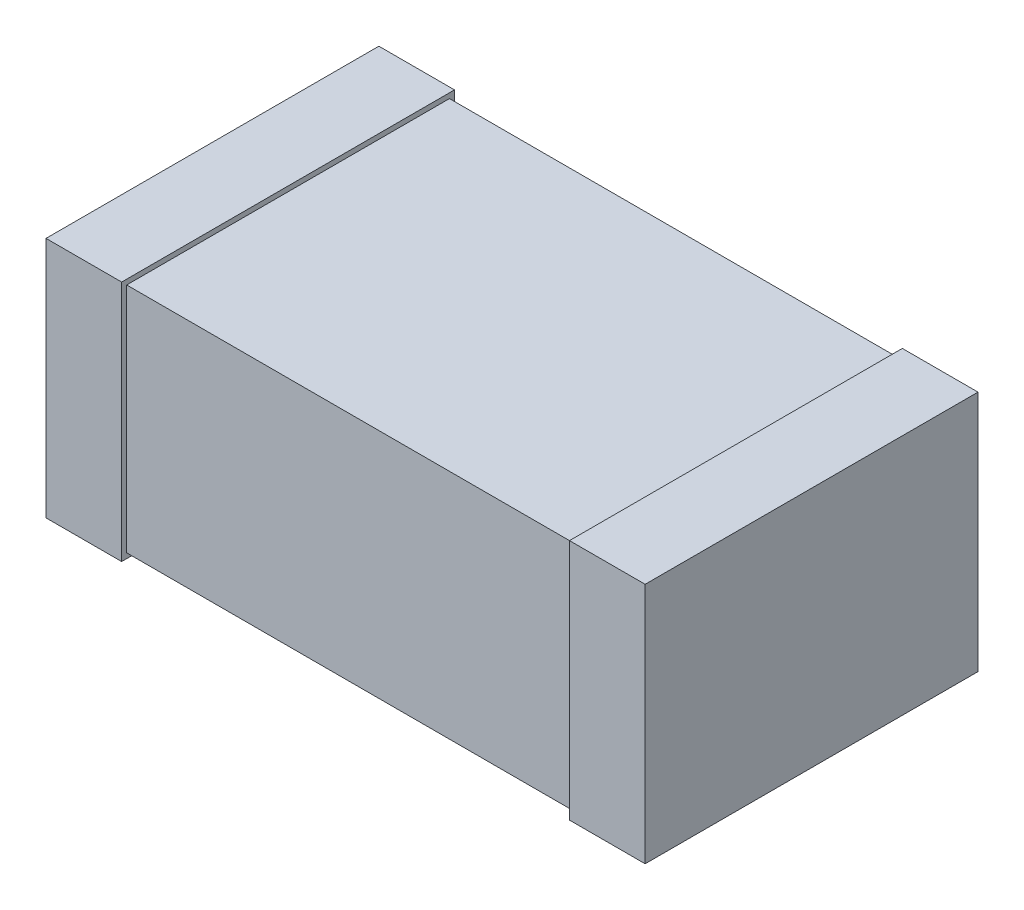
from build123d import *

# Parameters (mm, degrees)
SKETCH1_W           = 4.5
SKETCH1_H           = 3.2
BOSS_EXTRUDE1_DEPTH = 2.3
BOSS_EXTRUDE2_START = -0.03
SKETCH2_W           = 3.3
SKETCH2_H           = 2.4
BOSS_EXTRUDE2_DEPTH = 0.75


with BuildPart() as part:
    # Sketch1 → Boss-Extrude1 (new body)
    with BuildSketch(Plane(origin=(0, 0, 0), x_dir=(1, 0, 0), z_dir=(0, 1, 0))):
        Rectangle(SKETCH1_W, SKETCH1_H)
    extrude(amount=BOSS_EXTRUDE1_DEPTH)

    # Sketch2 → Boss-Extrude2 (add)
    with BuildSketch(Plane(origin=(2.25, 0, 0), x_dir=(0, 0, -1), z_dir=(1, 0, 0)).offset(BOSS_EXTRUDE2_START)):
        with Locations((0, 1.15)):
            Rectangle(SKETCH2_W, SKETCH2_H)
    boss_extrude2 = extrude(amount=BOSS_EXTRUDE2_DEPTH)

    # Mirror1: Boss-Extrude2 across plane
    add(boss_extrude2.mirror(Plane(origin=(0, 0, 0), x_dir=(0, 0, 1), z_dir=(1, 0, 0))))


solid = part.part
